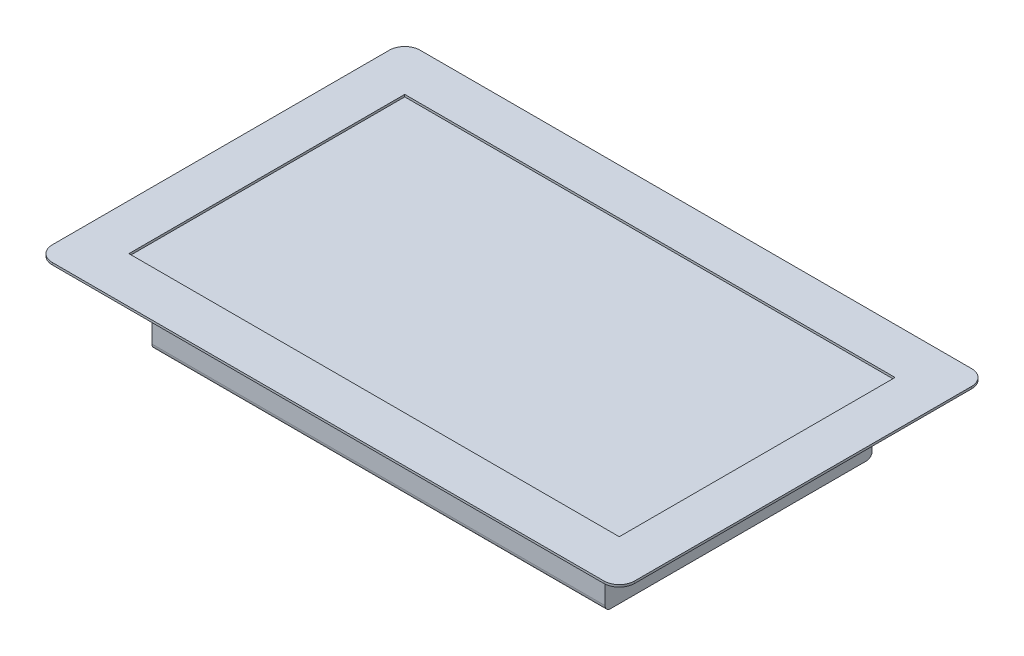
from build123d import *

# Parameters (mm, degrees)
SKETCH1_W           = 266
SKETCH1_H           = 168
BOSS_EXTRUDE1_DEPTH = 1
SKETCH2_W           = 247
SKETCH2_H           = 149
BOSS_EXTRUDE2_DEPTH = 7
BOSS_EXTRUDE3_DEPTH = 103.5
FILLET1_R           = 7
FILLET2_R           = 1
FILLET3_R           = 2.5
SKETCH4_W           = 224
SKETCH4_H           = 126
CUT_EXTRUDE1_DEPTH  = 1


with BuildPart() as part:
    # Sketch1 → Boss-Extrude1 (new body)
    with BuildSketch(Plane(origin=(0, 0, 0), x_dir=(1, 0, 0), z_dir=(0, 1, 0))):
        Rectangle(SKETCH1_W, SKETCH1_H)
    extrude(amount=BOSS_EXTRUDE1_DEPTH)

    # Sketch2 → Boss-Extrude2 (add)
    with BuildSketch(Plane(origin=(0, 0, 0), x_dir=(1, 0, 0), z_dir=(0, 1, 0))):
        Rectangle(SKETCH2_W, SKETCH2_H)
    extrude(amount=-BOSS_EXTRUDE2_DEPTH)

    # Sketch3 → Boss-Extrude3 (add, symmetric)
    with BuildSketch(Plane(origin=(0, 0, 0), x_dir=(0, 0, -1), z_dir=(1, 0, 0))):
        Polygon((-73, -7), (73, -7), (73, -8), (61, -8), (61, -34), (-61, -34), (-61, -8), (-73, -8), align=None)
    extrude(amount=BOSS_EXTRUDE3_DEPTH, both=True)

    # Fillet1
    fillet1_edges = [part.edges().sort_by_distance(p)[0] for p in [
        (-133, 0.5, -84),
        (133, 0.5, -84),
        (133, 0.5, 84),
        (-133, 0.5, 84),
    ]]
    fillet(fillet1_edges, radius=FILLET1_R)

    # Fillet2
    fillet2_edges = [part.edges().sort_by_distance(p)[0] for p in [
        (-123.5, -3.5, 74.5),
        (-123.5, -3.5, -74.5),
        (123.5, -3.5, -74.5),
        (123.5, -3.5, 74.5),
    ]]
    fillet(fillet2_edges, radius=FILLET2_R)

    # Fillet3
    fillet3_edges = [part.edges().sort_by_distance(p)[0] for p in [
        (-103.5, -7.5, 73),
        (0, -34, 61),
        (0, -34, -61),
        (-103.5, -7.5, -73),
        (103.5, -7.5, 73),
        (103.5, -7.5, -73),
    ]]
    fillet(fillet3_edges, radius=FILLET3_R)

    # Sketch4 → Cut-Extrude1 (cut)
    with BuildSketch(Plane(origin=(0, 1, 0), x_dir=(1, 0, 0), z_dir=(0, 1, 0))):
        Rectangle(SKETCH4_W, SKETCH4_H)
    extrude(amount=-CUT_EXTRUDE1_DEPTH, mode=Mode.SUBTRACT)


solid = part.part
